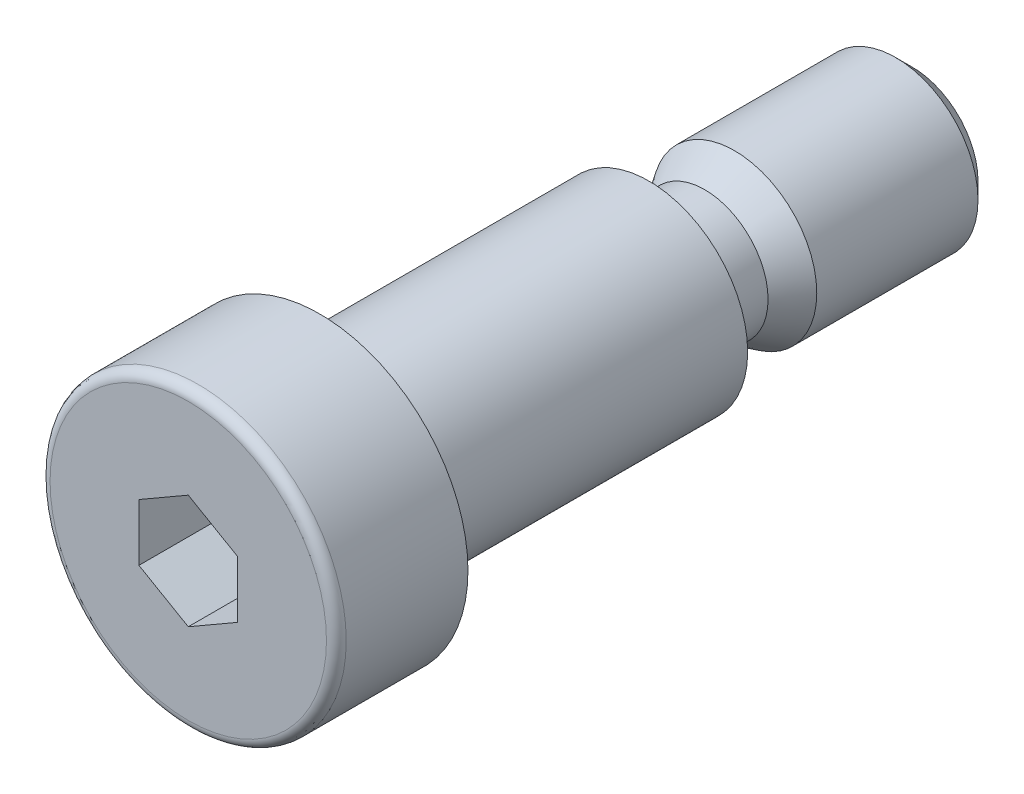
from build123d import *

# Parameters (mm, degrees)
SZKIC1_W                   = 3.85
SZKIC1_H                   = 3.39
WYTNIJ_WYCI_GNI_CIE1_DEPTH = 4.9
ZAOKR_GLENIE1_R            = 0.6


with BuildPart() as part:
    # Szkic1 → Obrót1 (revolve)
    with BuildSketch(Plane(origin=(0, 0, 0), x_dir=(1, 0, 0), z_dir=(0, 1, 0)), mode=Mode.PRIVATE) as obr_t1_sk:
        Polygon((0, -18), (0, -10), (-6, -10), (-9, -10), (-9, -18), align=None)
        Polygon((0, -10), (0, 10), (-3.85, 10), (-6, 10), (-6, -10), align=None)
        with Locations((-1.925, 11.695)):
            Rectangle(SZKIC1_W, SZKIC1_H)
        Polygon((-3.85, 13.39), (0, 13.39), (0, 26), (-4, 26), (-5, 25), (-5, 15.2), align=None)
    revolve(obr_t1_sk.sketch.rotate(Axis((0, 0, 18), (0, 0, -1)), 180), axis=Axis((0, 0, 18), (0, 0, -1)))

    # Szkic2 → Wytnij-wyciągnięcie1 (cut)
    with BuildSketch(Plane.XY.offset(18)):
        Polygon((3, 1.732050808), (0, 3.464101615), (-3, 1.732050808), (-3, -1.732050808), (0, -3.464101615), (3, -1.732050808), align=None)
    extrude(amount=-WYTNIJ_WYCI_GNI_CIE1_DEPTH, mode=Mode.SUBTRACT)

    # Zaokrąglenie1
    zaokr_glenie1_edges = [part.edges().sort_by_distance(p)[0] for p in [
        (-9, 0, 18),
    ]]
    fillet(zaokr_glenie1_edges, radius=ZAOKR_GLENIE1_R)


solid = part.part
